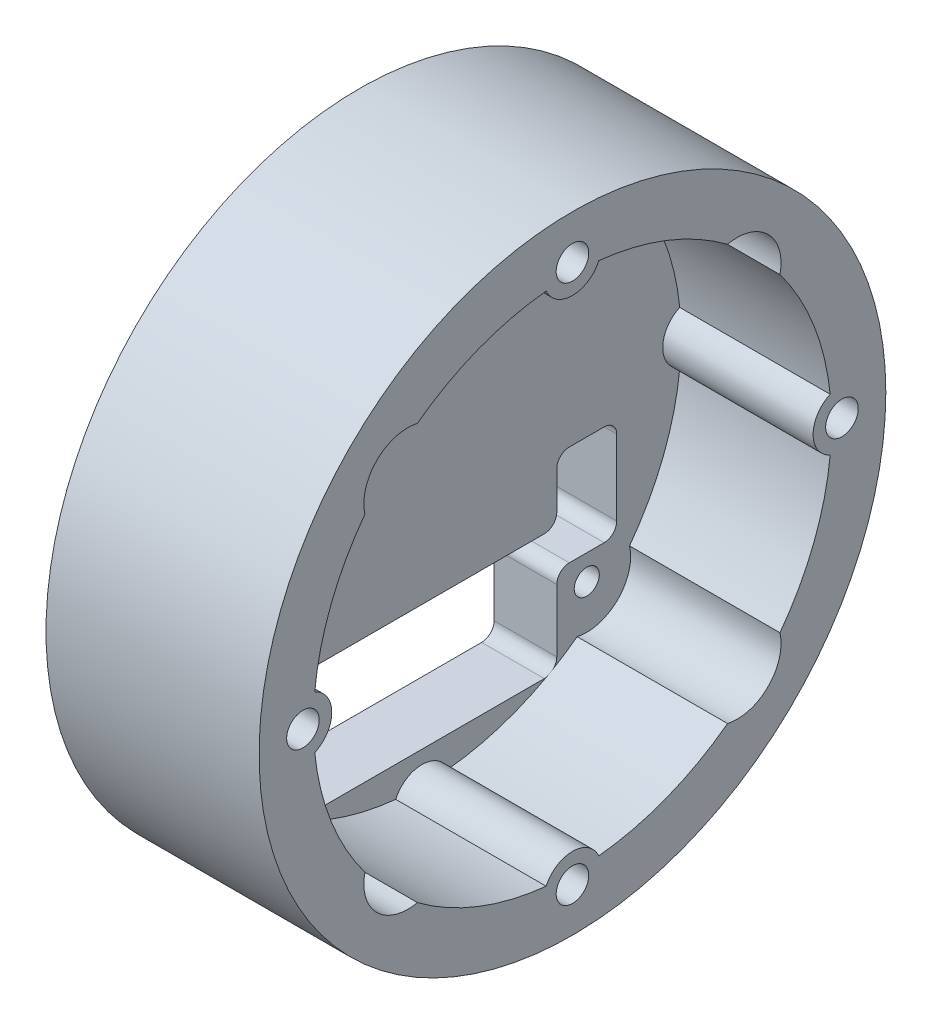
from build123d import *

# Parameters (mm, degrees)
SKETCH1_R               = 25
BOSS_EXTRUDE1_DEPTH     = 5
SKETCH3_R               = 1
CUT_EXTRUDE2_DEPTH      = 36.707142143
SKETCH4_R               = 25
SKETCH4_R_2             = 20.666666667
BOSS_EXTRUDE2_DEPTH     = 12
CUT_EXTRUDE1_DEPTH      = 38.336309405
CUT_EXTRUDE1_DEPTH_BACK = 38.336309405
SKETCH2_R               = 1.3
CUT_EXTRUDE3_DEPTH      = 38.336309405
CUT_EXTRUDE5_DEPTH      = 38.336309405
SKETCH8_R               = 2.3
SKETCH8_R_2             = 1.3
BOSS_EXTRUDE3_DEPTH     = 12


with BuildPart() as part:
    # Sketch1 → Boss-Extrude1 (new body)
    with BuildSketch(Plane(origin=(0, 0, 0), x_dir=(0, 0, -1), z_dir=(1, 0, 0))):
        Circle(SKETCH1_R)
    extrude(amount=BOSS_EXTRUDE1_DEPTH)

    # Sketch3 → Cut-Extrude2 (cut, through all)
    with BuildSketch(Plane.ZY):
        with Locations((-13.14, 13.14)):
            Circle(SKETCH3_R)
        with Locations((13.14, 13.14)):
            Circle(SKETCH3_R)
        with Locations((13.14, -13.14)):
            Circle(SKETCH3_R)
        with Locations((-13.14, -13.14)):
            Circle(SKETCH3_R)
    extrude(amount=-CUT_EXTRUDE2_DEPTH, mode=Mode.SUBTRACT)

    # Sketch4 → Boss-Extrude2 (add)
    with BuildSketch(Plane(origin=(5, 0, 0), x_dir=(0, 0, -1), z_dir=(1, 0, 0))):
        Circle(SKETCH4_R)
        Circle(SKETCH4_R_2, mode=Mode.SUBTRACT)
    extrude(amount=BOSS_EXTRUDE2_DEPTH)

    # Sketch2 → Cut-Extrude1 (cut, two sides: drawn at the far end of the back side and taken through both)
    with BuildSketch(Plane(origin=(5, 0, 0), x_dir=(0, 0, -1), z_dir=(1, 0, 0)).offset(-CUT_EXTRUDE1_DEPTH_BACK)):
        with Locations((0, 21.5)):
            Circle(SKETCH2_R)
        with Locations((21.5, 0)):
            Circle(SKETCH2_R)
        with Locations((0, -21.5)):
            Circle(SKETCH2_R)
        with Locations((-21.5, 0)):
            Circle(SKETCH2_R)
    extrude(amount=CUT_EXTRUDE1_DEPTH + CUT_EXTRUDE1_DEPTH_BACK, mode=Mode.SUBTRACT)

    # Sketch5 → Cut-Extrude3 (cut, through all)
    with BuildSketch(Plane(origin=(5, 0, 0), x_dir=(0, 0, -1), z_dir=(1, 0, 0))):
        with BuildLine():
            Line((9.75, -8.14), (-9.75, -8.14))
            ThreePointArc((-9.75, -8.14), (-10.457106781, -8.432893219), (-10.75, -9.14))
            Line((-10.75, -9.14), (-10.75, -17.14))
            ThreePointArc((-10.75, -17.14), (-10.457106781, -17.847106781), (-9.75, -18.14))
            Line((-9.75, -18.14), (9.75, -18.14))
            ThreePointArc((9.75, -18.14), (10.457106781, -17.847106781), (10.75, -17.14))
            Line((10.75, -17.14), (10.75, -12.14))
            ThreePointArc((10.75, -12.14), (11.042893219, -11.432893219), (11.75, -11.14))
            Line((11.75, -11.14), (14.53, -11.14))
            ThreePointArc((14.53, -11.14), (15.237106781, -10.847106781), (15.53, -10.14))
            Line((15.53, -10.14), (15.53, -4.14))
            ThreePointArc((15.53, -4.14), (15.237106781, -3.432893219), (14.53, -3.14))
            Line((14.53, -3.14), (11.75, -3.14))
            ThreePointArc((11.75, -3.14), (11.042893219, -3.432893219), (10.75, -4.14))
            Line((10.75, -4.14), (10.75, -7.14))
            ThreePointArc((10.75, -7.14), (10.457106781, -7.847106781), (9.75, -8.14))
        make_face()
    extrude(amount=-CUT_EXTRUDE3_DEPTH, mode=Mode.SUBTRACT)

    # Sketch7 → Cut-Extrude5 (cut, through all)
    with BuildSketch(Plane(origin=(5, 0, 0), x_dir=(0, 0, -1), z_dir=(1, 0, 0))):
        with BuildLine():
            Line((-10.665126266, 15.614873734), (0, 4.949747468))
            Line((0, 4.949747468), (10.665126266, 15.614873734))
            ThreePointArc((10.665126266, 15.614873734), (15.614873734, 15.614873734), (15.614873734, 10.665126266))
            Line((15.614873734, 10.665126266), (4.949747468, 0))
            Line((4.949747468, 0), (15.614873734, -10.665126266))
            ThreePointArc((15.614873734, -10.665126266), (15.614873734, -15.614873734), (10.665126266, -15.614873734))
            Line((10.665126266, -15.614873734), (0, -4.949747468))
            Line((0, -4.949747468), (-10.665126266, -15.614873734))
            ThreePointArc((-10.665126266, -15.614873734), (-15.614873734, -15.614873734), (-15.614873734, -10.665126266))
            Line((-15.614873734, -10.665126266), (-4.949747468, 0))
            Line((-4.949747468, 0), (-15.614873734, 10.665126266))
            ThreePointArc((-15.614873734, 10.665126266), (-15.614873734, 15.614873734), (-10.665126266, 15.614873734))
        make_face()
    extrude(amount=CUT_EXTRUDE5_DEPTH, mode=Mode.SUBTRACT)

    # Sketch8 → Boss-Extrude3 (add)
    # profile 1 of 4: a face of its own
    with BuildSketch(Plane(origin=(5, 0, 0), x_dir=(0, 0, -1), z_dir=(1, 0, 0))):
        with Locations((0, -21.5)):
            Circle(SKETCH8_R)
        with Locations((0, -21.5)):
            Circle(SKETCH8_R_2, mode=Mode.SUBTRACT)
    # profile 2 of 4: a face of its own
    with BuildSketch(Plane(origin=(5, 0, 0), x_dir=(0, 0, -1), z_dir=(1, 0, 0))):
        with Locations((-21.5, 0)):
            Circle(SKETCH8_R)
        with Locations((-21.5, 0)):
            Circle(SKETCH8_R_2, mode=Mode.SUBTRACT)
    # profile 3 of 4: a face of its own
    with BuildSketch(Plane(origin=(5, 0, 0), x_dir=(0, 0, -1), z_dir=(1, 0, 0))):
        with Locations((0, 21.5)):
            Circle(SKETCH8_R)
        with Locations((0, 21.5)):
            Circle(SKETCH8_R_2, mode=Mode.SUBTRACT)
    # profile 4 of 4: a face of its own
    with BuildSketch(Plane(origin=(5, 0, 0), x_dir=(0, 0, -1), z_dir=(1, 0, 0))):
        with Locations((21.5, 0)):
            Circle(SKETCH8_R)
        with Locations((21.5, 0)):
            Circle(SKETCH8_R_2, mode=Mode.SUBTRACT)
    extrude(amount=BOSS_EXTRUDE3_DEPTH)


solid = part.part
